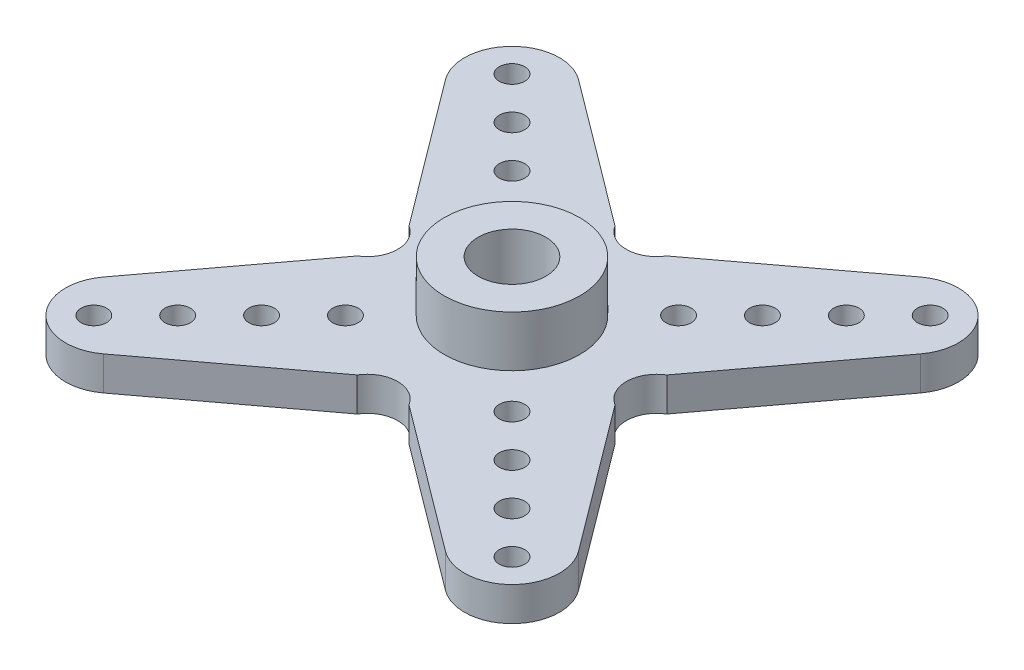
from build123d import *

# Parameters (mm, degrees)
BOSS_EXTRUDE1_DEPTH          = 2
SKETCH5_R                    = 4
SKETCH5_R_2                  = 1.998542518
BOSS_EXTRUDE2_DEPTH          = 3
SKETCH8_R                    = 1.5
CUT_EXTRUDE2_DEPTH           = 30.027201103
SKETCH9_R                    = 3.6
SKETCH9_R_2                  = 3
BOSS_EXTRUDE3_DEPTH          = 0.85
CUT_EXTRUDE3_REACH           = 31.027
SKETCH10_R                   = 0.75
LPATTERN1_COUNT              = 4
LPATTERN1_PITCH              = 3.5
CIRPATTERN1_COPY_1_REACH     = 31.027
CIRPATTERN1_COPY_1_SKETCH_R  = 0.75
CIRPATTERN1_COPY_2_REACH     = 31.027
CIRPATTERN1_COPY_2_SKETCH_R  = 0.75
CIRPATTERN1_COPY_3_REACH     = 31.027
CIRPATTERN1_COPY_3_SKETCH_R  = 0.75
CIRPATTERN1_COPY_4_REACH     = 31.027
CIRPATTERN1_COPY_4_SKETCH_R  = 0.75
CIRPATTERN1_COPY_5_REACH     = 31.027
CIRPATTERN1_COPY_5_SKETCH_R  = 0.75
CIRPATTERN1_COPY_6_REACH     = 31.027
CIRPATTERN1_COPY_6_SKETCH_R  = 0.75
CIRPATTERN1_COPY_7_REACH     = 31.027
CIRPATTERN1_COPY_7_SKETCH_R  = 0.75
CIRPATTERN1_COPY_8_REACH     = 31.027
CIRPATTERN1_COPY_8_SKETCH_R  = 0.75
CIRPATTERN1_COPY_9_REACH     = 31.027
CIRPATTERN1_COPY_9_SKETCH_R  = 0.75
CIRPATTERN1_COPY_10_REACH    = 31.027
CIRPATTERN1_COPY_10_SKETCH_R = 0.75
CIRPATTERN1_COPY_11_REACH    = 31.027
CIRPATTERN1_COPY_11_SKETCH_R = 0.75
CIRPATTERN1_COPY_12_REACH    = 31.027
CIRPATTERN1_COPY_12_SKETCH_R = 0.75


with BuildPart() as part:
    # Sketch1 → Boss-Extrude1 (new body)
    with BuildSketch(Plane(origin=(0, 0, 0), x_dir=(1, 0, 0), z_dir=(0, 1, 0))):
        with BuildLine():
            Line((11.195476756, 1.969359322), (4.786657556, -6.592741724))
            ThreePointArc((4.786657556, -6.592741724), (3.929987754, -8.118293207), (4.786657556, -9.643844691))
            Line((4.786657556, -9.643844691), (11.195476756, -18.205945736))
            ThreePointArc((11.195476756, -18.205945736), (10.933214648, -21.871520101), (7.267640283, -22.133782209))
            Line((7.267640283, -22.133782209), (-1.294460762, -15.724963009))
            ThreePointArc((-1.294460762, -15.724963009), (-2.820012246, -14.868293207), (-4.34556373, -15.724963009))
            Line((-4.34556373, -15.724963009), (-12.907664775, -22.133782209))
            ThreePointArc((-12.907664775, -22.133782209), (-16.57323914, -21.871520101), (-16.835501248, -18.205945736))
            Line((-16.835501248, -18.205945736), (-10.426682048, -9.643844691))
            ThreePointArc((-10.426682048, -9.643844691), (-9.570012246, -8.118293207), (-10.426682048, -6.592741724))
            Line((-10.426682048, -6.592741724), (-16.835501248, 1.969359322))
            ThreePointArc((-16.835501248, 1.969359322), (-16.57323914, 5.634933687), (-12.907664775, 5.897195795))
            Line((-12.907664775, 5.897195795), (-4.34556373, -0.511623405))
            ThreePointArc((-4.34556373, -0.511623405), (-2.820012246, -1.368293207), (-1.294460762, -0.511623405))
            Line((-1.294460762, -0.511623405), (7.267640283, 5.897195795))
            ThreePointArc((7.267640283, 5.897195795), (10.933214648, 5.634933687), (11.195476756, 1.969359322))
        make_face()
    extrude(amount=BOSS_EXTRUDE1_DEPTH)

    # Sketch5 → Boss-Extrude2 (add)
    with BuildSketch(Plane(origin=(0, 2, 0), x_dir=(1, 0, 0), z_dir=(0, 1, 0))):
        with Locations((-2.820012246, -8.118293207)):
            Circle(SKETCH5_R)
        with Locations((-2.820012246, -8.118293207)):
            Circle(SKETCH5_R_2, mode=Mode.SUBTRACT)
    extrude(amount=BOSS_EXTRUDE2_DEPTH)

    # Sketch8 → Cut-Extrude2 (cut, through all)
    with BuildSketch(Plane.XZ):
        with Locations((-2.820012246, 8.118293207)):
            Circle(SKETCH8_R)
    extrude(amount=-CUT_EXTRUDE2_DEPTH, mode=Mode.SUBTRACT)

    # Sketch9 → Boss-Extrude3 (add)
    with BuildSketch(Plane.XZ):
        with Locations((-2.820012246, 8.118293207)):
            Circle(SKETCH9_R)
        with Locations((-2.820012246, 8.118293207)):
            Circle(SKETCH9_R_2, mode=Mode.SUBTRACT)
    extrude(amount=BOSS_EXTRUDE3_DEPTH)

    # Sketch10 → Cut-Extrude3 (cut, up to next)
    with BuildSketch(Plane.XZ, mode=Mode.PRIVATE) as cut_extrude3_sk1:
        with Locations((9.519001086, -4.220720125)):
            Circle(SKETCH10_R)
    cut_extrude3_tool1 = extrude(cut_extrude3_sk1.sketch, amount=-CUT_EXTRUDE3_REACH, mode=Mode.PRIVATE) & part.part
    cut_extrude3 = cut_extrude3_tool1.solids().sort_by_distance((9.519001, 0, -4.22072))[0]
    add(cut_extrude3, mode=Mode.SUBTRACT)

    # LPattern1: Cut-Extrude3 ×4
    with Locations(*[Vector(-0.707106781186547, 0, 0.707106781186548) * (i * LPATTERN1_PITCH) for i in range(1, LPATTERN1_COUNT)]):
        add(cut_extrude3, mode=Mode.SUBTRACT)

    # CirPattern1 copy 1 sketch → CirPattern1 copy 1 (cut, up to next)
    with BuildSketch(Plane(origin=(2.823407227, 0, 8.463431719), x_dir=(0, 0, 1), z_dir=(0, -1, 0)), mode=Mode.PRIVATE) as cirpattern1_copy_1_sk1:
        with Locations((9.519001086, -4.220720125)):
            Circle(CIRPATTERN1_COPY_1_SKETCH_R)
    cirpattern1_copy_1_tool1 = extrude(cirpattern1_copy_1_sk1.sketch, amount=-CIRPATTERN1_COPY_1_REACH, mode=Mode.PRIVATE) & part.part
    add(cirpattern1_copy_1_tool1.solids().sort_by_distance((7.044127227, 0, 17.982432719))[0], mode=Mode.SUBTRACT)

    # CirPattern1 copy 2 sketch → CirPattern1 copy 2 (cut, up to next)
    with BuildSketch(Plane(origin=(-3.165150758, 0, 13.76171268), x_dir=(-1, 0, 0), z_dir=(0, -1, 0)), mode=Mode.PRIVATE) as cirpattern1_copy_2_sk1:
        with Locations((9.519001086, -4.220720125)):
            Circle(CIRPATTERN1_COPY_2_SKETCH_R)
    cirpattern1_copy_2_tool1 = extrude(cirpattern1_copy_2_sk1.sketch, amount=-CIRPATTERN1_COPY_2_REACH, mode=Mode.PRIVATE) & part.part
    add(cirpattern1_copy_2_tool1.solids().sort_by_distance((-12.684151758, 0, 17.98243268))[0], mode=Mode.SUBTRACT)

    # CirPattern1 copy 3 sketch → CirPattern1 copy 3 (cut, up to next)
    with BuildSketch(Plane(origin=(-8.463431719, 0, 7.773154695), x_dir=(0, 0, -1), z_dir=(0, -1, 0)), mode=Mode.PRIVATE) as cirpattern1_copy_3_sk1:
        with Locations((9.519001086, -4.220720125)):
            Circle(CIRPATTERN1_COPY_3_SKETCH_R)
    cirpattern1_copy_3_tool1 = extrude(cirpattern1_copy_3_sk1.sketch, amount=-CIRPATTERN1_COPY_3_REACH, mode=Mode.PRIVATE) & part.part
    add(cirpattern1_copy_3_tool1.solids().sort_by_distance((-12.684151719, 0, -1.745846305))[0], mode=Mode.SUBTRACT)

    # CirPattern1 copy 4 sketch → CirPattern1 copy 4 (cut, up to next)
    with BuildSketch(Plane(origin=(0.348533493, 0, 5.988557985), x_dir=(0, 0, 1), z_dir=(0, -1, 0)), mode=Mode.PRIVATE) as cirpattern1_copy_4_sk1:
        with Locations((9.519001086, -4.220720125)):
            Circle(CIRPATTERN1_COPY_4_SKETCH_R)
    cirpattern1_copy_4_tool1 = extrude(cirpattern1_copy_4_sk1.sketch, amount=-CIRPATTERN1_COPY_4_REACH, mode=Mode.PRIVATE) & part.part
    add(cirpattern1_copy_4_tool1.solids().sort_by_distance((4.569253493, 0, 15.507558985))[0], mode=Mode.SUBTRACT)

    # CirPattern1 copy 5 sketch → CirPattern1 copy 5 (cut, up to next)
    with BuildSketch(Plane(origin=(-0.690277024, 0, 11.286838946), x_dir=(-1, 0, 0), z_dir=(0, -1, 0)), mode=Mode.PRIVATE) as cirpattern1_copy_5_sk1:
        with Locations((9.519001086, -4.220720125)):
            Circle(CIRPATTERN1_COPY_5_SKETCH_R)
    cirpattern1_copy_5_tool1 = extrude(cirpattern1_copy_5_sk1.sketch, amount=-CIRPATTERN1_COPY_5_REACH, mode=Mode.PRIVATE) & part.part
    add(cirpattern1_copy_5_tool1.solids().sort_by_distance((-10.209278024, 0, 15.507558946))[0], mode=Mode.SUBTRACT)

    # CirPattern1 copy 6 sketch → CirPattern1 copy 6 (cut, up to next)
    with BuildSketch(Plane(origin=(-5.988557985, 0, 10.248028429), x_dir=(0, 0, -1), z_dir=(0, -1, 0)), mode=Mode.PRIVATE) as cirpattern1_copy_6_sk1:
        with Locations((9.519001086, -4.220720125)):
            Circle(CIRPATTERN1_COPY_6_SKETCH_R)
    cirpattern1_copy_6_tool1 = extrude(cirpattern1_copy_6_sk1.sketch, amount=-CIRPATTERN1_COPY_6_REACH, mode=Mode.PRIVATE) & part.part
    add(cirpattern1_copy_6_tool1.solids().sort_by_distance((-10.209277985, 0, 0.729027429))[0], mode=Mode.SUBTRACT)

    # CirPattern1 copy 7 sketch → CirPattern1 copy 7 (cut, up to next)
    with BuildSketch(Plane(origin=(-2.126340241, 0, 3.513684251), x_dir=(0, 0, 1), z_dir=(0, -1, 0)), mode=Mode.PRIVATE) as cirpattern1_copy_7_sk1:
        with Locations((9.519001086, -4.220720125)):
            Circle(CIRPATTERN1_COPY_7_SKETCH_R)
    cirpattern1_copy_7_tool1 = extrude(cirpattern1_copy_7_sk1.sketch, amount=-CIRPATTERN1_COPY_7_REACH, mode=Mode.PRIVATE) & part.part
    add(cirpattern1_copy_7_tool1.solids().sort_by_distance((2.094379759, 0, 13.032685251))[0], mode=Mode.SUBTRACT)

    # CirPattern1 copy 8 sketch → CirPattern1 copy 8 (cut, up to next)
    with BuildSketch(Plane(origin=(1.78459671, 0, 8.811965212), x_dir=(-1, 0, 0), z_dir=(0, -1, 0)), mode=Mode.PRIVATE) as cirpattern1_copy_8_sk1:
        with Locations((9.519001086, -4.220720125)):
            Circle(CIRPATTERN1_COPY_8_SKETCH_R)
    cirpattern1_copy_8_tool1 = extrude(cirpattern1_copy_8_sk1.sketch, amount=-CIRPATTERN1_COPY_8_REACH, mode=Mode.PRIVATE) & part.part
    add(cirpattern1_copy_8_tool1.solids().sort_by_distance((-7.73440429, 0, 13.032685212))[0], mode=Mode.SUBTRACT)

    # CirPattern1 copy 9 sketch → CirPattern1 copy 9 (cut, up to next)
    with BuildSketch(Plane(origin=(-3.513684251, 0, 12.722902164), x_dir=(0, 0, -1), z_dir=(0, -1, 0)), mode=Mode.PRIVATE) as cirpattern1_copy_9_sk1:
        with Locations((9.519001086, -4.220720125)):
            Circle(CIRPATTERN1_COPY_9_SKETCH_R)
    cirpattern1_copy_9_tool1 = extrude(cirpattern1_copy_9_sk1.sketch, amount=-CIRPATTERN1_COPY_9_REACH, mode=Mode.PRIVATE) & part.part
    add(cirpattern1_copy_9_tool1.solids().sort_by_distance((-7.734404251, 0, 3.203901164))[0], mode=Mode.SUBTRACT)

    # CirPattern1 copy 10 sketch → CirPattern1 copy 10 (cut, up to next)
    with BuildSketch(Plane(origin=(5.298280961, 0, 10.938305453), x_dir=(0, 0, 1), z_dir=(0, -1, 0)), mode=Mode.PRIVATE) as cirpattern1_copy_10_sk1:
        with Locations((9.519001086, -4.220720125)):
            Circle(CIRPATTERN1_COPY_10_SKETCH_R)
    cirpattern1_copy_10_tool1 = extrude(cirpattern1_copy_10_sk1.sketch, amount=-CIRPATTERN1_COPY_10_REACH, mode=Mode.PRIVATE) & part.part
    add(cirpattern1_copy_10_tool1.solids().sort_by_distance((9.519000961, 0, 20.457306453))[0], mode=Mode.SUBTRACT)

    # CirPattern1 copy 11 sketch → CirPattern1 copy 11 (cut, up to next)
    with BuildSketch(Plane(origin=(-5.640024492, 0, 16.236586414), x_dir=(-1, 0, 0), z_dir=(0, -1, 0)), mode=Mode.PRIVATE) as cirpattern1_copy_11_sk1:
        with Locations((9.519001086, -4.220720125)):
            Circle(CIRPATTERN1_COPY_11_SKETCH_R)
    cirpattern1_copy_11_tool1 = extrude(cirpattern1_copy_11_sk1.sketch, amount=-CIRPATTERN1_COPY_11_REACH, mode=Mode.PRIVATE) & part.part
    add(cirpattern1_copy_11_tool1.solids().sort_by_distance((-15.159025492, 0, 20.457306414))[0], mode=Mode.SUBTRACT)

    # CirPattern1 copy 12 sketch → CirPattern1 copy 12 (cut, up to next)
    with BuildSketch(Plane(origin=(-10.938305453, 0, 5.298280961), x_dir=(0, 0, -1), z_dir=(0, -1, 0)), mode=Mode.PRIVATE) as cirpattern1_copy_12_sk1:
        with Locations((9.519001086, -4.220720125)):
            Circle(CIRPATTERN1_COPY_12_SKETCH_R)
    cirpattern1_copy_12_tool1 = extrude(cirpattern1_copy_12_sk1.sketch, amount=-CIRPATTERN1_COPY_12_REACH, mode=Mode.PRIVATE) & part.part
    add(cirpattern1_copy_12_tool1.solids().sort_by_distance((-15.159025453, 0, -4.220720039))[0], mode=Mode.SUBTRACT)


solid = part.part
